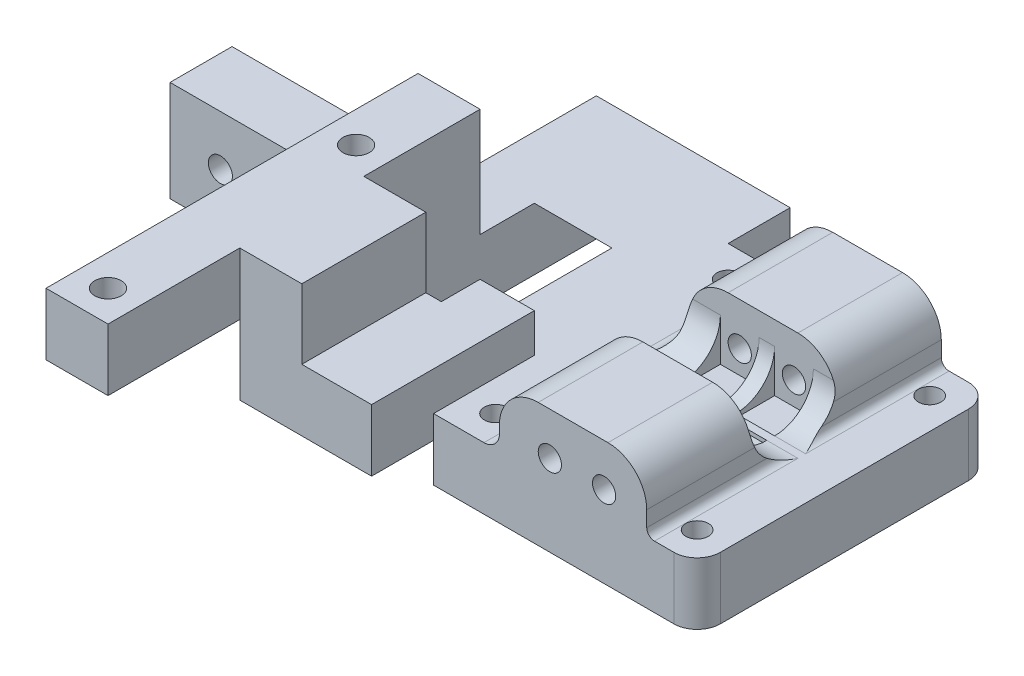
from build123d import *

# Parameters (mm, degrees)
SKETCH1_W                 = 300
SKETCH1_H                 = 20
BOSS_EXTRUDE1_DEPTH       = 8
SKETCH2_W                 = 34
SKETCH2_H                 = 8
BOSS_EXTRUDE2_DEPTH       = 9
SKETCH3_W                 = 34
SKETCH3_H                 = 8
BOSS_EXTRUDE3_DEPTH       = 9
SKETCH4_R                 = 1.45
CUT_EXTRUDE1_DEPTH        = 302.504560496
SKETCH5_W                 = 25
SKETCH5_H                 = 8
BOSS_EXTRUDE4_DEPTH       = 17
SKETCH6_W                 = 25
SKETCH6_H                 = 8
BOSS_EXTRUDE5_DEPTH       = 17
SKETCH12_W                = 8
SKETCH12_H                = 8
BOSS_EXTRUDE7_DEPTH       = 17
SKETCH18_W                = 20
SKETCH18_H                = 13
BOSS_EXTRUDE10_DEPTH      = 12
SKETCH19_R                = 1.6
CUT_EXTRUDE9_DEPTH        = 20
SKETCH20_W                = 20
SKETCH20_H                = 13
BOSS_EXTRUDE11_DEPTH      = 12
SKETCH21_R                = 1.6
CUT_EXTRUDE10_DEPTH       = 20
SKETCH22_W                = 10
SKETCH22_H                = 38
CUT_EXTRUDE11_DEPTH       = 306.0983448
SKETCH23_W                = 8
SKETCH23_H                = 18
CUT_EXTRUDE12_DEPTH       = 4
BOSS_EXTRUDE12_DEPTH      = 10
BOSS_EXTRUDE13_DEPTH      = 8
SKETCH26_W                = 8
SKETCH26_H                = 48
BOSS_EXTRUDE14_DEPTH      = 14
SKETCH27_W                = 8
SKETCH27_H                = 16
BOSS_EXTRUDE15_DEPTH      = 14
SKETCH28_W                = 8
SKETCH28_H                = 40
CUT_EXTRUDE13_DEPTH       = 14
SKETCH30_W                = 16
SKETCH30_H                = 14
BOSS_EXTRUDE16_DEPTH      = 9
SKETCH31_W                = 17
SKETCH31_H                = 8
CUT_EXTRUDE14_DEPTH       = 5
SKETCH32_W                = 16
SKETCH32_H                = 9
CUT_EXTRUDE15_DEPTH       = 9
CUT_EXTRUDE16_DEPTH       = 10
SKETCH34_W                = 7
SKETCH34_H                = 5
CUT_EXTRUDE17_DEPTH       = 5
SKETCH35_W                = 7
SKETCH35_H                = 5
BOSS_EXTRUDE17_DEPTH      = 5
SKETCH36_R                = 1.7
CUT_EXTRUDE18_DEPTH       = 307.014705529
SKETCH37_W                = 70
SKETCH37_H                = 8
BOSS_EXTRUDE18_DEPTH      = 5
SKETCH39_W                = 66
SKETCH39_H                = 6
CUT_EXTRUDE19_DEPTH       = 306.14258962
SKETCH40_W                = 20
SKETCH40_H                = 12
BOSS_EXTRUDE19_DEPTH      = 10
BOSS_EXTRUDE20_DEPTH      = 5
BOSS_EXTRUDE20_DEPTH_BACK = 5
SKETCH41_W                = 28
SKETCH41_H                = 12
SKETCH42_R                = 1.5
CUT_EXTRUDE20_DEPTH       = 15
SKETCH43_W                = 20
SKETCH43_H                = 12
BOSS_EXTRUDE21_DEPTH      = 10
BOSS_EXTRUDE22_DEPTH      = 5
BOSS_EXTRUDE22_DEPTH_BACK = 5
SKETCH44_W                = 28
SKETCH44_H                = 12
SKETCH45_R                = 1.5
CUT_EXTRUDE21_DEPTH       = 15
SKETCH49_R                = 1.45
CUT_EXTRUDE23_DEPTH       = 306.190104689
SKETCH50_W                = 99.073016947
SKETCH50_H                = 52.119345881
CUT_EXTRUDE24_DEPTH       = 220
SKETCH51_W                = 21
SKETCH51_H                = 6
CUT_EXTRUDE25_DEPTH       = 306.14258962
SKETCH52_R                = 1.55
CUT_EXTRUDE26_DEPTH       = 305.611227633
FILLET5_R                 = 3
SKETCH54_W                = 19
SKETCH54_H                = 13.5
BOSS_EXTRUDE26_DEPTH      = 8
FILLET6_R                 = 5
SKETCH55_R                = 1.5
CUT_EXTRUDE27_DEPTH       = 308.332067966
FILLET7_R                 = 5
FILLET8_R                 = 1
FILLET9_R                 = 2
SKETCH56_W                = 5
SKETCH56_H                = 5
CUT_EXTRUDE28_DEPTH       = 8.5


with BuildPart() as part:
    # Sketch1 → Boss-Extrude1 (new body)
    with BuildSketch(Plane(origin=(0, 0, 0), x_dir=(1, 0, 0), z_dir=(0, 1, 0))):
        with Locations((150, -10)):
            Rectangle(SKETCH1_W, SKETCH1_H)
    extrude(amount=BOSS_EXTRUDE1_DEPTH)

    # Sketch2 → Boss-Extrude2 (add)
    with BuildSketch(Plane.XY.offset(20)):
        with Locations((17, 4)):
            Rectangle(SKETCH2_W, SKETCH2_H)
        with Locations((283, 4)):
            Rectangle(SKETCH2_W, SKETCH2_H)
    extrude(amount=BOSS_EXTRUDE2_DEPTH)

    # Sketch3 → Boss-Extrude3 (add)
    with BuildSketch(Plane(origin=(0, 0, 0), x_dir=(-1, 0, 0), z_dir=(0, 0, -1))):
        with Locations((-17, 4)):
            Rectangle(SKETCH3_W, SKETCH3_H)
        with Locations((-283, 4)):
            Rectangle(SKETCH3_W, SKETCH3_H)
    extrude(amount=BOSS_EXTRUDE3_DEPTH)

    # Sketch4 → Cut-Extrude1 (cut, through all)
    with BuildSketch(Plane(origin=(0, 8, 0), x_dir=(1, 0, 0), z_dir=(0, 1, 0))):
        with Locations(Location((4, 5, 0), (0, 0, 270))):
            Circle(SKETCH4_R)
        with Locations(Location((30, 5, 0), (0, 0, 270))):
            Circle(SKETCH4_R)
        with Locations(Location((30, -25, 0), (0, 0, 270))):
            Circle(SKETCH4_R)
        with Locations(Location((4, -25, 0), (0, 0, 270))):
            Circle(SKETCH4_R)
        with Locations(Location((296, -25, 0), (0, 0, 270))):
            Circle(SKETCH4_R)
        with Locations(Location((296, 5, 0), (0, 0, 270))):
            Circle(SKETCH4_R)
        with Locations(Location((270, -25, 0), (0, 0, 270))):
            Circle(SKETCH4_R)
        with Locations(Location((270, 5, 0), (0, 0, 270))):
            Circle(SKETCH4_R)
    extrude(amount=-CUT_EXTRUDE1_DEPTH, mode=Mode.SUBTRACT)

    # Sketch5 → Boss-Extrude4 (add)
    with BuildSketch(Plane.XY.offset(20)):
        with Locations((253.5, 4)):
            Rectangle(SKETCH5_W, SKETCH5_H)
    extrude(amount=BOSS_EXTRUDE4_DEPTH)

    # Sketch6 → Boss-Extrude5 (add)
    with BuildSketch(Plane(origin=(0, 0, 0), x_dir=(-1, 0, 0), z_dir=(0, 0, -1))):
        with Locations((-253.5, 4)):
            Rectangle(SKETCH6_W, SKETCH6_H)
    extrude(amount=BOSS_EXTRUDE5_DEPTH)

    # Sketch12 → Boss-Extrude7 (add)
    with BuildSketch(Plane.XY.offset(37)):
        with Locations((245, 4)):
            Rectangle(SKETCH12_W, SKETCH12_H)
    extrude(amount=BOSS_EXTRUDE7_DEPTH)

    # Sketch18 → Boss-Extrude10 (add)
    with BuildSketch(Plane(origin=(0, 0, -9), x_dir=(-1, 0, 0), z_dir=(0, 0, -1))):
        with Locations((-15, 1.5)):
            Rectangle(SKETCH18_W, SKETCH18_H)
    extrude(amount=BOSS_EXTRUDE10_DEPTH)

    # Sketch19 → Cut-Extrude9 (cut)
    with BuildSketch(Plane.ZY.offset(-5)):
        with Locations((-15, 0)):
            Circle(SKETCH19_R)
    extrude(amount=-CUT_EXTRUDE9_DEPTH, mode=Mode.SUBTRACT)

    # Sketch20 → Boss-Extrude11 (add)
    with BuildSketch(Plane.XY.offset(29)):
        with Locations((15, 1.5)):
            Rectangle(SKETCH20_W, SKETCH20_H)
    extrude(amount=BOSS_EXTRUDE11_DEPTH)

    # Sketch21 → Cut-Extrude10 (cut)
    with BuildSketch(Plane.ZY.offset(-5)):
        with Locations((35, 0)):
            Circle(SKETCH21_R)
    extrude(amount=-CUT_EXTRUDE10_DEPTH, mode=Mode.SUBTRACT)

    # Sketch22 → Cut-Extrude11 (cut, through all)
    with BuildSketch(Plane(origin=(0, 8, 0), x_dir=(1, 0, 0), z_dir=(0, 1, 0))):
        with Locations((254, -10)):
            Rectangle(SKETCH22_W, SKETCH22_H)
    extrude(amount=-CUT_EXTRUDE11_DEPTH, mode=Mode.SUBTRACT)

    # Sketch23 → Cut-Extrude12 (cut)
    with BuildSketch(Plane(origin=(0, 0, 0), x_dir=(-1, 0, 0), z_dir=(0, -1, 0))):
        with Locations((-263, -10)):
            Rectangle(SKETCH23_W, SKETCH23_H)
    extrude(amount=-CUT_EXTRUDE12_DEPTH, mode=Mode.SUBTRACT)

    # Sketch24 → Boss-Extrude12 (add)
    with BuildSketch(Plane.ZY.offset(-259)):
        Polygon((-9, 0), (-9, 8), (-1, 8), align=None)
        Polygon((29, 0), (29, 8), (21, 8), align=None)
    extrude(amount=BOSS_EXTRUDE12_DEPTH)

    # Sketch25 → Boss-Extrude13 (add)
    with BuildSketch(Plane.ZY.offset(-267)):
        Polygon((19, 0), (19, 4), (15, 4), align=None)
        Polygon((1, 4), (5, 4), (1, 0), align=None)
    extrude(amount=BOSS_EXTRUDE13_DEPTH)

    # Sketch26 → Boss-Extrude14 (add)
    with BuildSketch(Plane(origin=(0, 8, 0), x_dir=(1, 0, 0), z_dir=(0, 1, 0))):
        with Locations((245, -30)):
            Rectangle(SKETCH26_W, SKETCH26_H)
    extrude(amount=BOSS_EXTRUDE14_DEPTH)

    # Sketch27 → Boss-Extrude15 (add)
    with BuildSketch(Plane(origin=(0, 8, 0), x_dir=(1, 0, 0), z_dir=(0, 1, 0))):
        with Locations((253, -29)):
            Rectangle(SKETCH27_W, SKETCH27_H)
    extrude(amount=BOSS_EXTRUDE15_DEPTH)

    # Sketch28 → Cut-Extrude13 (cut)
    with BuildSketch(Plane.XZ):
        with Locations((245, 34)):
            Rectangle(SKETCH28_W, SKETCH28_H)
    extrude(amount=-CUT_EXTRUDE13_DEPTH, mode=Mode.SUBTRACT)

    # Sketch30 → Boss-Extrude16 (add)
    with BuildSketch(Plane(origin=(257, 0, 0), x_dir=(0, 0, -1), z_dir=(1, 0, 0))):
        with Locations((-29, 15)):
            Rectangle(SKETCH30_W, SKETCH30_H)
    extrude(amount=BOSS_EXTRUDE16_DEPTH)

    # Sketch31 → Cut-Extrude14 (cut)
    with BuildSketch(Plane(origin=(0, 0, 0), x_dir=(-1, 0, 0), z_dir=(0, -1, 0))):
        with Locations((-257.5, -33)):
            Rectangle(SKETCH31_W, SKETCH31_H)
    extrude(amount=-CUT_EXTRUDE14_DEPTH, mode=Mode.SUBTRACT)

    # Sketch32 → Cut-Extrude15 (cut)
    with BuildSketch(Plane(origin=(266, 0, 0), x_dir=(0, 0, -1), z_dir=(1, 0, 0))):
        with Locations((-29, 17.5)):
            Rectangle(SKETCH32_W, SKETCH32_H)
    extrude(amount=-CUT_EXTRUDE15_DEPTH, mode=Mode.SUBTRACT)

    # Sketch33 → Cut-Extrude16 (cut)
    with BuildSketch(Plane.ZY.offset(-249)):
        Polygon((29, 5), (24, 5), (29, 0), align=None)
    extrude(amount=-CUT_EXTRUDE16_DEPTH, mode=Mode.SUBTRACT)

    # Sketch34 → Cut-Extrude17 (cut)
    with BuildSketch(Plane.XY.offset(29)):
        with Locations((262.5, 2.5)):
            Rectangle(SKETCH34_W, SKETCH34_H)
    extrude(amount=-CUT_EXTRUDE17_DEPTH, mode=Mode.SUBTRACT)

    # Sketch35 → Boss-Extrude17 (add)
    with BuildSketch(Plane(origin=(0, 0, 21), x_dir=(-1, 0, 0), z_dir=(0, 0, -1))):
        with Locations((-262.5, 10.5)):
            Rectangle(SKETCH35_W, SKETCH35_H)
    extrude(amount=BOSS_EXTRUDE17_DEPTH)

    # Sketch36 → Cut-Extrude18 (cut, through all)
    with BuildSketch(Plane(origin=(0, 22, 0), x_dir=(1, 0, 0), z_dir=(0, 1, 0))):
        with Locations(Location((245, -50, 0), (0, 0, 270))):
            Circle(SKETCH36_R)
        with Locations(Location((245, -18, 0), (0, 0, 270))):
            Circle(SKETCH36_R)
    extrude(amount=-CUT_EXTRUDE18_DEPTH, mode=Mode.SUBTRACT)

    # Sketch37 → Boss-Extrude18 (add)
    with BuildSketch(Plane(origin=(0, 8, 0), x_dir=(1, 0, 0), z_dir=(0, 1, 0))):
        with Locations((206, -10)):
            Rectangle(SKETCH37_W, SKETCH37_H)
    extrude(amount=BOSS_EXTRUDE18_DEPTH)

    # Sketch39 → Cut-Extrude19 (cut, through all)
    with BuildSketch(Plane(origin=(0, 8, 0), x_dir=(1, 0, 0), z_dir=(0, 1, 0))):
        with Locations((208, -17)):
            Rectangle(SKETCH39_W, SKETCH39_H)
    extrude(amount=-CUT_EXTRUDE19_DEPTH, mode=Mode.SUBTRACT)

    # Sketch40 → Boss-Extrude19 (add)
    with BuildSketch(Plane(origin=(0, 8, 0), x_dir=(1, 0, 0), z_dir=(0, 1, 0))):
        with Locations((15, 15)):
            Rectangle(SKETCH40_W, SKETCH40_H)
    extrude(amount=BOSS_EXTRUDE19_DEPTH)

    # Sketch41 → Boss-Extrude20 (add, two sides: drawn at the far end of the back side and taken through both)
    with BuildSketch(Plane(origin=(0, 18, 0), x_dir=(1, 0, 0), z_dir=(0, 1, 0)).offset(-BOSS_EXTRUDE20_DEPTH_BACK)):
        with Locations((11, 15)):
            Rectangle(SKETCH41_W, SKETCH41_H)
    extrude(amount=BOSS_EXTRUDE20_DEPTH + BOSS_EXTRUDE20_DEPTH_BACK)

    # Sketch42 → Cut-Extrude20 (cut)
    with BuildSketch(Plane.ZY.offset(3)):
        with Locations((-14, 18)):
            Circle(SKETCH42_R)
    extrude(amount=-CUT_EXTRUDE20_DEPTH, mode=Mode.SUBTRACT)

    # Sketch43 → Boss-Extrude21 (add)
    with BuildSketch(Plane(origin=(0, 8, 0), x_dir=(1, 0, 0), z_dir=(0, 1, 0))):
        with Locations((15, -35)):
            Rectangle(SKETCH43_W, SKETCH43_H)
    extrude(amount=BOSS_EXTRUDE21_DEPTH)

    # Sketch44 → Boss-Extrude22 (add, two sides: drawn at the far end of the back side and taken through both)
    with BuildSketch(Plane(origin=(0, 18, 0), x_dir=(1, 0, 0), z_dir=(0, 1, 0)).offset(-BOSS_EXTRUDE22_DEPTH_BACK)):
        with Locations((11, -35)):
            Rectangle(SKETCH44_W, SKETCH44_H)
    extrude(amount=BOSS_EXTRUDE22_DEPTH + BOSS_EXTRUDE22_DEPTH_BACK)

    # Sketch45 → Cut-Extrude21 (cut)
    with BuildSketch(Plane.ZY.offset(3)):
        with Locations((36, 18)):
            Circle(SKETCH45_R)
    extrude(amount=-CUT_EXTRUDE21_DEPTH, mode=Mode.SUBTRACT)

    # Sketch49 → Cut-Extrude23 (cut, through all)
    with BuildSketch(Plane(origin=(0, 8, 0), x_dir=(1, 0, 0), z_dir=(0, 1, 0))):
        with Locations(Location((78, -8, 0), (0, 0, 270))):
            Circle(SKETCH49_R)
        with Locations(Location((78, -12, 0), (0, 0, 270))):
            Circle(SKETCH49_R)
    extrude(amount=-CUT_EXTRUDE23_DEPTH, mode=Mode.SUBTRACT)

    # Sketch50 → Cut-Extrude24 (cut)
    with BuildSketch(Plane.ZY.offset(3)):
        with Locations((14.374840952, 8.537402255)):
            Rectangle(SKETCH50_W, SKETCH50_H)
    extrude(amount=-CUT_EXTRUDE24_DEPTH, mode=Mode.SUBTRACT)

    # Sketch51 → Cut-Extrude25 (cut, through all)
    with BuildSketch(Plane(origin=(0, 8, 0), x_dir=(1, 0, 0), z_dir=(0, 1, 0))):
        with Locations((227.5, -3)):
            Rectangle(SKETCH51_W, SKETCH51_H)
    extrude(amount=-CUT_EXTRUDE25_DEPTH, mode=Mode.SUBTRACT)

    # Sketch52 → Cut-Extrude26 (cut, through all)
    with BuildSketch(Plane(origin=(0, 0, 6), x_dir=(-1, 0, 0), z_dir=(0, 0, -1))):
        with Locations((-223.5, 6.5)):
            Circle(SKETCH52_R)
        with Locations((-231.5, 6.5)):
            Circle(SKETCH52_R)
    extrude(amount=-CUT_EXTRUDE26_DEPTH, mode=Mode.SUBTRACT)

    # Fillet5
    fillet5_edges = [part.edges().sort_by_distance(p)[0] for p in [
        (300, 4, 29),
        (300, 4, -9),
    ]]
    fillet(fillet5_edges, radius=FILLET5_R)

    # Sketch54 → Boss-Extrude26 (add)
    with BuildSketch(Plane(origin=(0, 8, 0), x_dir=(1, 0, 0), z_dir=(0, 1, 0))):
        with Locations((284, 2.25)):
            Rectangle(SKETCH54_W, SKETCH54_H)
        with Locations((284, -22.25)):
            Rectangle(SKETCH54_W, SKETCH54_H)
    extrude(amount=BOSS_EXTRUDE26_DEPTH)

    # Fillet6
    fillet6_edges = [part.edges().sort_by_distance(p)[0] for p in [
        (284, 8, 4.5),
        (284, 8, 15.5),
    ]]
    fillet(fillet6_edges, radius=FILLET6_R)

    # Sketch55 → Cut-Extrude27 (cut, through all)
    with BuildSketch(Plane(origin=(0, 0, -9), x_dir=(-1, 0, 0), z_dir=(0, 0, -1))):
        with Locations((-288, 10.5)):
            Circle(SKETCH55_R)
        with Locations((-281, 10.5)):
            Circle(SKETCH55_R)
    extrude(amount=-CUT_EXTRUDE27_DEPTH, mode=Mode.SUBTRACT)

    # Fillet7
    fillet7_edges = [part.edges().sort_by_distance(p)[0] for p in [
        (274.5, 16, -2.25),
        (293.5, 16, -2.25),
        (274.5, 16, 22.25),
        (293.5, 16, 22.25),
    ]]
    fillet(fillet7_edges, radius=FILLET7_R)

    # Fillet8
    fillet8_edges = [part.edges().sort_by_distance(p)[0] for p in [
        (293.5, 8, 0.25),
        (293.5, 8, 19.75),
    ]]
    fillet(fillet8_edges, radius=FILLET8_R)

    # Fillet9
    fillet9_edges = [part.edges().sort_by_distance(p)[0] for p in [
        (274.5, 8, 0.25),
        (274.5, 8, 19.75),
    ]]
    fillet(fillet9_edges, radius=FILLET9_R)

    # Sketch56 → Cut-Extrude28 (cut)
    with BuildSketch(Plane(origin=(0, 16, 0), x_dir=(1, 0, 0), z_dir=(0, 1, 0))):
        with Locations((281, -13)):
            Rectangle(SKETCH56_W, SKETCH56_H)
        with Locations((288, -13)):
            Rectangle(SKETCH56_W, SKETCH56_H)
        with Locations((281, -7)):
            Rectangle(SKETCH56_W, SKETCH56_H)
        with Locations((288, -7)):
            Rectangle(SKETCH56_W, SKETCH56_H)
    extrude(amount=-CUT_EXTRUDE28_DEPTH, mode=Mode.SUBTRACT)


solid = part.part
